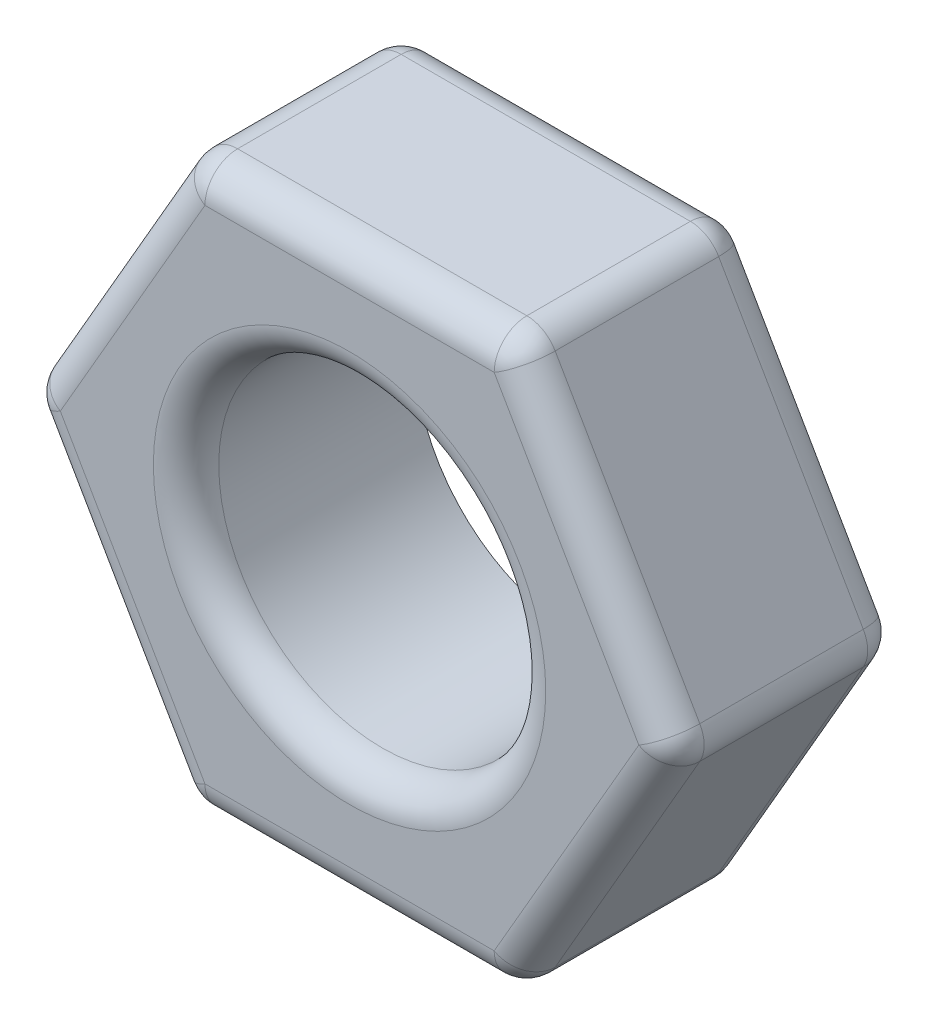
from build123d import *

# Parameters (mm, degrees)
SKETCH1_R           = 5
BOSS_EXTRUDE1_DEPTH = 7
FILLET1_R           = 1
FILLET2_R           = 1


with BuildPart() as part:
    # Sketch1 → Boss-Extrude1 (new body)
    with BuildSketch(Plane.XY):
        Polygon((10, 0), (5, 8.660254038), (-5, 8.660254038), (-10, 0), (-5, -8.660254038), (5, -8.660254038), align=None)
        Circle(SKETCH1_R, mode=Mode.SUBTRACT)
    extrude(amount=BOSS_EXTRUDE1_DEPTH)

    # Fillet1
    fillet1_edges = [part.edges().sort_by_distance(p)[0] for p in [
        (5, -8.660254038, 3.5),
        (-5, -8.660254038, 3.5),
        (-10, 0, 3.5),
        (-5, 8.660254038, 3.5),
        (5, 8.660254038, 3.5),
        (10, 0, 3.5),
        (-5, 0, 7),
    ]]
    fillet(fillet1_edges, radius=FILLET1_R)

    # Fillet2
    fillet2_edges = [part.edges().sort_by_distance(p)[0] for p in [
        (7.5, -4.330127019, 7),
        (7.5, 4.330127019, 7),
        (0, 8.660254038, 7),
        (-7.5, 4.330127019, 7),
        (-7.5, -4.330127019, 7),
        (0, -8.660254038, 7),
        (4.922649731, 8.526279442, 7),
        (-4.922649731, 8.526279442, 7),
        (-9.845299462, 0, 7),
        (-4.922649731, -8.526279442, 7),
        (4.922649731, -8.526279442, 7),
        (9.845299462, 0, 7),
        (7.5, 4.330127019, 0),
        (7.5, -4.330127019, 0),
        (0, -8.660254038, 0),
        (-7.5, -4.330127019, 0),
        (-7.5, 4.330127019, 0),
        (0, 8.660254038, 0),
        (4.922649731, 8.526279442, 0),
        (-4.922649731, 8.526279442, 0),
        (-9.845299462, 0, 0),
        (-4.922649731, -8.526279442, 0),
        (4.922649731, -8.526279442, 0),
        (9.845299462, 0, 0),
    ]]
    fillet(fillet2_edges, radius=FILLET2_R)


solid = part.part
